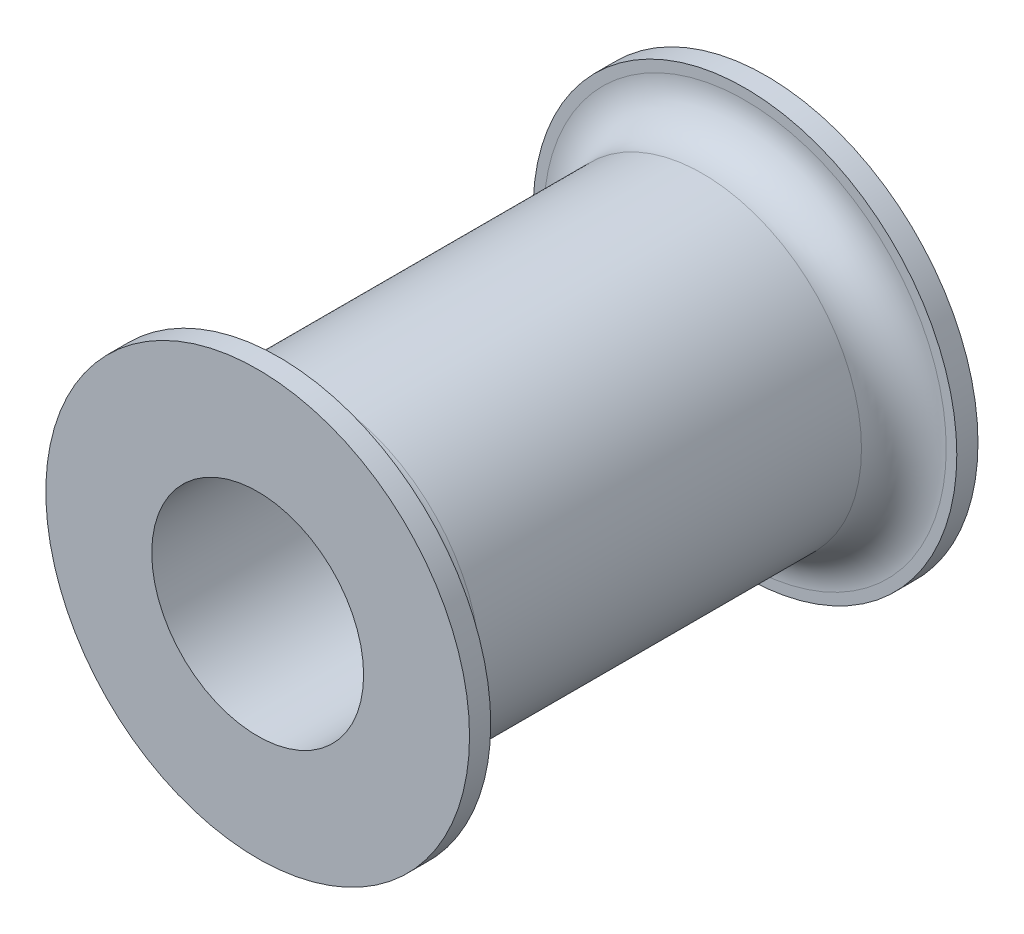
from build123d import *

# Parameters (mm, degrees)
SKETCH_1_R          = 5
EXTRUDE_1_DEPTH     = 0.5
SKETCH_2_R          = 3.75
EXTRUDE_2_DEPTH     = 11
SKETCH_3_R          = 5
EXTRUDE_3_DEPTH     = 0.5
SKETCH_4_R          = 2.5
CUT_EXTRUDE_1_DEPTH = 14.928388277
FILLET_1_R          = 1


with BuildPart() as part:
    # 草图1 → 凸台-拉伸1 (new body)
    with BuildSketch(Plane.XY):
        Circle(SKETCH_1_R)
    extrude(amount=EXTRUDE_1_DEPTH)

    # 草图2 → 凸台-拉伸2 (add)
    with BuildSketch(Plane.XY.offset(0.5)):
        Circle(SKETCH_2_R)
    extrude(amount=EXTRUDE_2_DEPTH)

    # 草图3 → 凸台-拉伸3 (add)
    with BuildSketch(Plane.XY.offset(11.5)):
        Circle(SKETCH_3_R)
    extrude(amount=EXTRUDE_3_DEPTH)

    # 草图4 → 切除-拉伸1 (cut, through all)
    with BuildSketch(Plane.XY.offset(12)):
        Circle(SKETCH_4_R)
    extrude(amount=-CUT_EXTRUDE_1_DEPTH, mode=Mode.SUBTRACT)

    # 圆角1
    fillet_1_edges = [part.edges().sort_by_distance(p)[0] for p in [
        (-3.75, 0, 0.5),
        (-3.75, 0, 11.5),
    ]]
    fillet(fillet_1_edges, radius=FILLET_1_R)


solid = part.part
